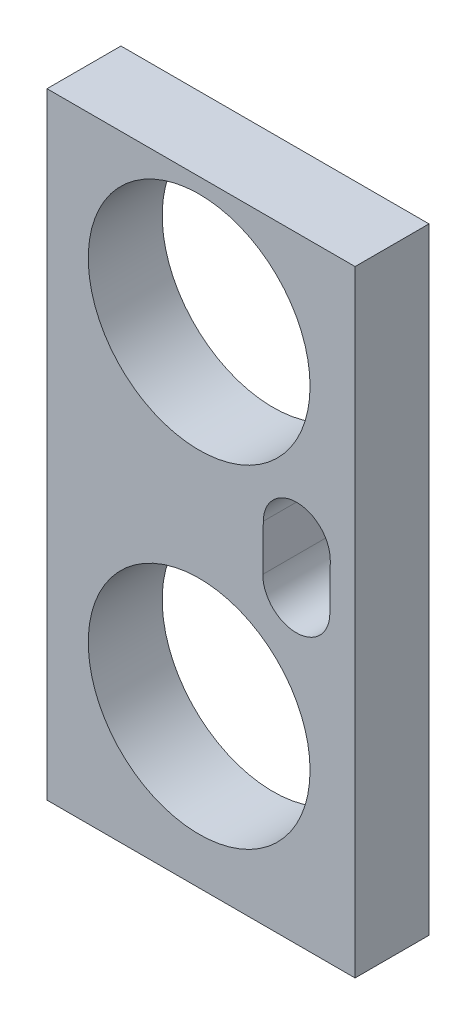
from build123d import *

# Parameters (mm, degrees)
SKETCH1_W           = 25
SKETCH1_H           = 50
BOSS_EXTRUDE1_DEPTH = 6
SKETCH2_R           = 9
CUT_EXTRUDE1_DEPTH  = 36.619307578


with BuildPart() as part:
    # Sketch1 → Boss-Extrude1 (new body)
    with BuildSketch(Plane.XY):
        with Locations((-3.289473684, -6.359649123)):
            Rectangle(SKETCH1_W, SKETCH1_H)
    extrude(amount=BOSS_EXTRUDE1_DEPTH)

    # Sketch2 → Cut-Extrude1 (cut, through all)
    with BuildSketch(Plane.XY.offset(6)):
        with Locations((-3.442256095, 8.409317212)):
            Circle(SKETCH2_R)
        with Locations((-3.442256095, -18.590682788)):
            Circle(SKETCH2_R)
        with BuildLine():
            Line((7.19958983, -3.041196046), (7.161332442, -6.790420083))
            ThreePointArc((7.161332442, -6.790420083), (4.414711412, -9.481553819), (1.723577676, -6.734932789))
            Line((1.723577676, -6.734932789), (1.761835064, -2.985708753))
            ThreePointArc((1.761835064, -2.985708753), (4.508456094, -0.294575016), (7.19958983, -3.041196046))
        make_face()
    extrude(amount=-CUT_EXTRUDE1_DEPTH, mode=Mode.SUBTRACT)


solid = part.part
